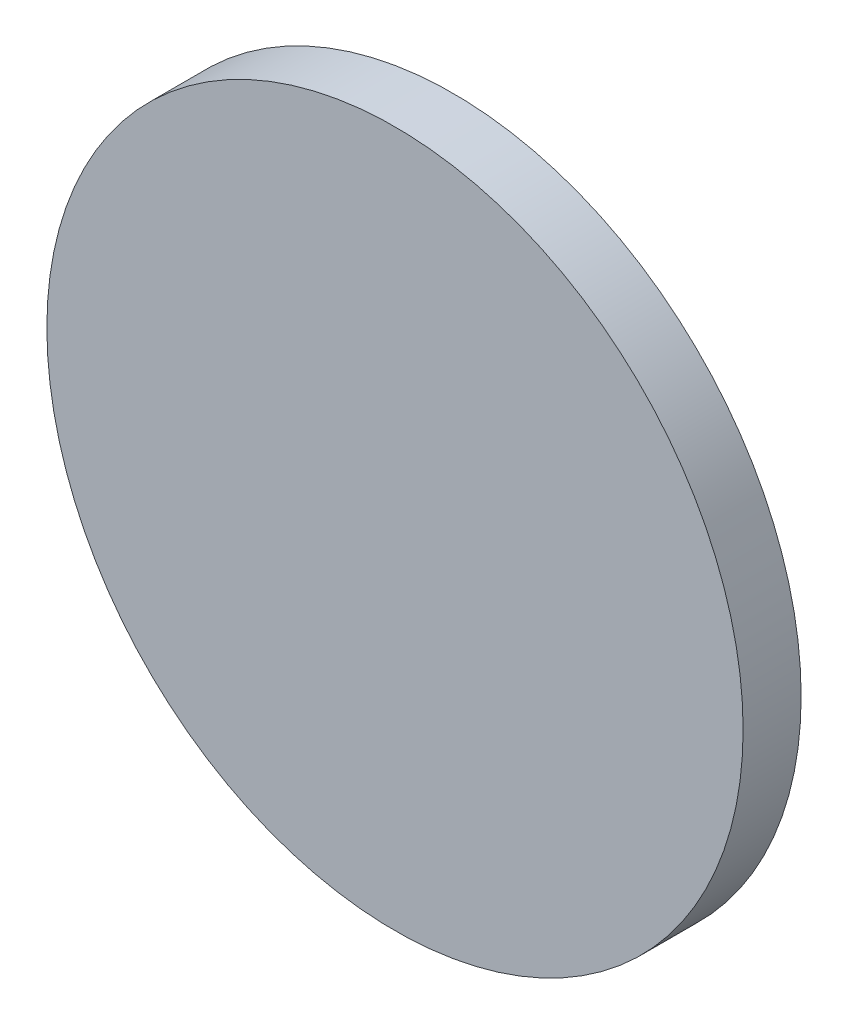
from build123d import *

# Parameters (mm, degrees)
SKETCH1_R           = 60
BOSS_EXTRUDE1_DEPTH = 10


with BuildPart() as part:
    # Sketch1 → Boss-Extrude1 (new body)
    with BuildSketch(Plane.XY):
        Circle(SKETCH1_R)
    extrude(amount=BOSS_EXTRUDE1_DEPTH)


solid = part.part
